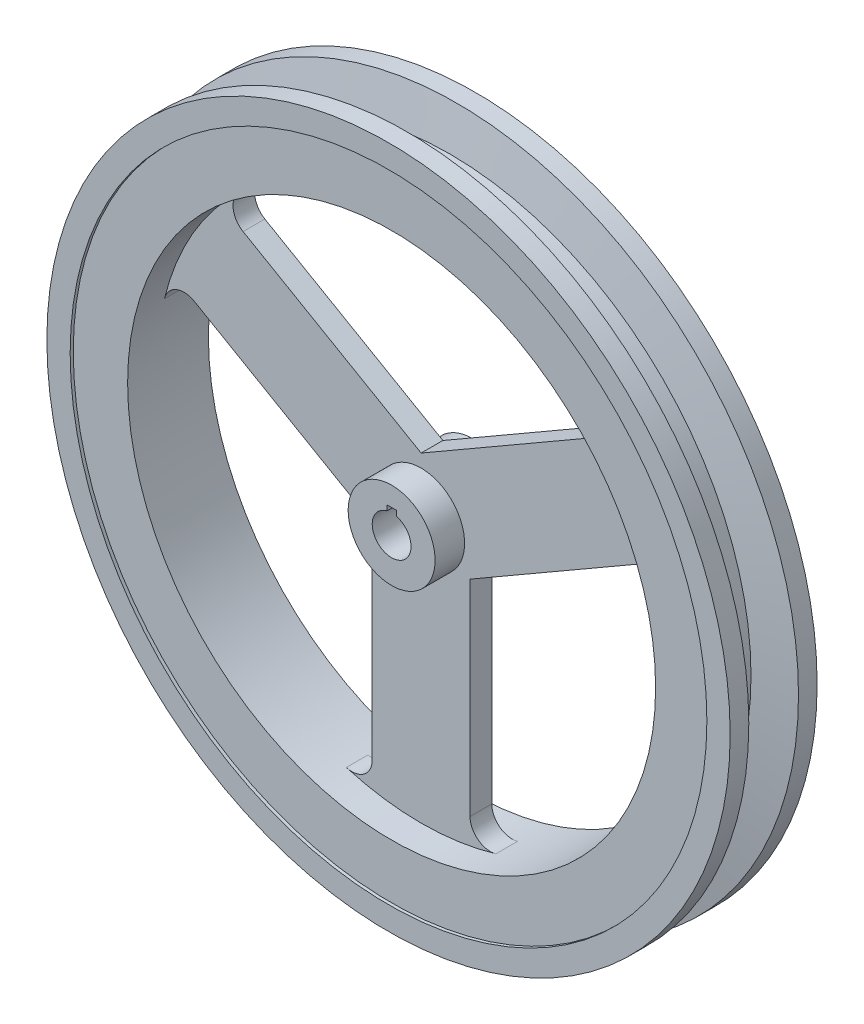
from build123d import *

# Parameters (mm, degrees)
EXTRUDE_1_DEPTH     = 3.5
FILLET_1_R          = 6.5
SKETCH_4_R          = 14
EXTRUDE_2_DEPTH     = 13
CUT_EXTRUDE_1_DEPTH = 13


with BuildPart() as part:
    # 草图2 → 旋转1 (revolve)
    with BuildSketch(Plane(origin=(0, 0, 0), x_dir=(0, 0, -1), z_dir=(1, 0, 0)), mode=Mode.PRIVATE) as revolve_1_sk:
        Polygon((14, 102.5), (14, 110), (8, 110), (5.707749251, 97), (-5.707749251, 97), (-8, 110), (-14, 110), (-14, 102.5), (-13, 102.5), (-13, 85), (13, 85), (13, 102.5), align=None)
    revolve(revolve_1_sk.sketch.rotate(Axis((0, 0, 67.916666667), (0, 0, -1)), 90), axis=Axis((0, 0, 67.916666667), (0, 0, -1)))

    # 草图3 → 凸台-拉伸1 (add, symmetric)
    with BuildSketch(Plane.XY):
        with BuildLine():
            Line((0, 18.186533479), (-64.462425479, 55.403932183))
            ThreePointArc((-64.462425479, 55.403932183), (-73.612159322, 42.5), (-80.212425479, 28.124131963))
            Line((-80.212425479, 28.124131963), (-15.75, -9.09326674))
            Line((-15.75, -9.09326674), (-15.75, -83.528064146))
            ThreePointArc((-15.75, -83.528064146), (0, -85), (15.75, -83.528064146))
            Line((15.75, -83.528064146), (15.75, -9.09326674))
            Line((15.75, -9.09326674), (80.212425479, 28.124131963))
            ThreePointArc((80.212425479, 28.124131963), (73.612159322, 42.5), (64.462425479, 55.403932183))
            Line((64.462425479, 55.403932183), (0, 18.186533479))
        make_face()
    extrude(amount=EXTRUDE_1_DEPTH, both=True)

    # 圆角1
    fillet_1_edges = [part.edges().sort_by_distance(p)[0] for p in [
        (64.462425479, 55.403932183, 0),
        (-64.462425479, 55.403932183, 0),
        (-80.212425479, 28.124131963, 0),
        (-15.75, -83.528064146, 0),
        (15.75, -83.528064146, 0),
        (80.212425479, 28.124131963, 0),
    ]]
    fillet(fillet_1_edges, radius=FILLET_1_R)

    # 草图4 → 凸台-拉伸2 (add, symmetric)
    with BuildSketch(Plane.XY):
        with Locations(Location((0, 0, 0), (0, 0, 180))):
            Circle(SKETCH_4_R)
    extrude(amount=EXTRUDE_2_DEPTH, both=True)

    # 草图5 → 切除-拉伸1 (cut, symmetric)
    with BuildSketch(Plane.XY):
        with BuildLine():
            Line((-1.5, 6.06733055), (-1.5, 7.75))
            Line((-1.5, 7.75), (1.5, 7.75))
            Line((1.5, 7.75), (1.5, 6.06733055))
            ThreePointArc((1.5, 6.06733055), (0, -6.25), (-1.5, 6.06733055))
        make_face()
    extrude(amount=CUT_EXTRUDE_1_DEPTH, both=True, mode=Mode.SUBTRACT)


solid = part.part
